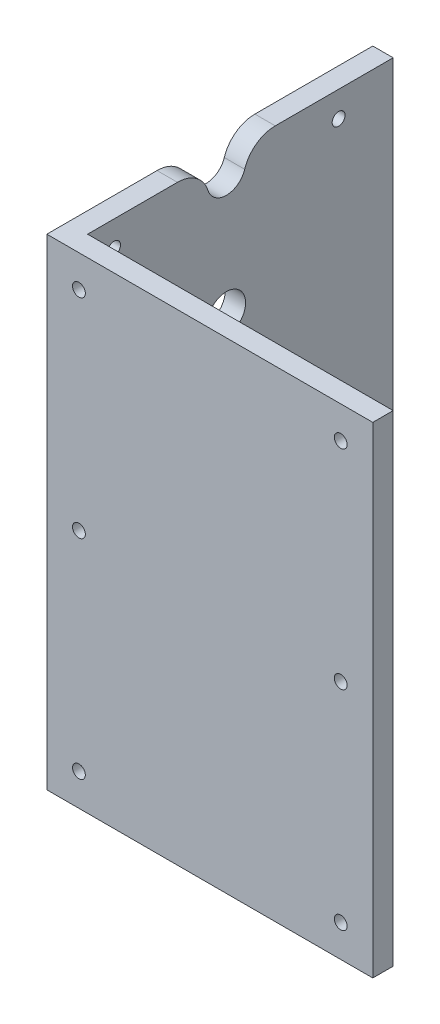
from build123d import *

# Parameters (mm, degrees)
SALIENTE_EXTRUIR1_DEPTH = 150
CROQUIS2_R              = 2
CROQUIS2_R_2            = 11
CROQUIS2_R_3            = 1.5
CROQUIS2_R_4            = 6
CORTAR_EXTRUIR1_DEPTH   = 208.714034191
REDONDEO1_R             = 10
CROQUIS3_R              = 12.5
CORTAR_EXTRUIR2_DEPTH   = 1.5
CROQUIS4_R              = 2
CROQUIS4_R_2            = 1.5
CORTAR_EXTRUIR3_DEPTH   = 208.714034191
CROQUIS6_R              = 2
CORTAR_EXTRUIR4_DEPTH   = 208.714034191


with BuildPart() as part:
    # Croquis1 → Saliente-Extruir1 (new body)
    with BuildSketch(Plane(origin=(0, 0, 0), x_dir=(1, 0, 0), z_dir=(0, 1, 0))):
        Polygon((0, 101.6), (0, 0), (101.6, 0), (101.6, 6.35), (6.35, 6.35), (6.35, 101.6), align=None)
    extrude(amount=SALIENTE_EXTRUIR1_DEPTH)

    # Croquis2 → Cortar-Extruir1 (cut, through all)
    with BuildSketch(Plane.ZY):
        with Locations((-84.6, 142)):
            Circle(CROQUIS2_R)
        with Locations((-14.6, 142)):
            Circle(CROQUIS2_R)
        with Locations((-49.6, 59.96)):
            Circle(CROQUIS2_R_2)
        with Locations((-49.6, 7.71)):
            Circle(CROQUIS2_R_3)
        with Locations((-49.6, 144.86)):
            Circle(CROQUIS2_R_4)
        with Locations((-49.6, 106.86)):
            Circle(CROQUIS2_R_4)
    extrude(amount=-CORTAR_EXTRUIR1_DEPTH, mode=Mode.SUBTRACT)

    # Redondeo1
    redondeo1_edges = [part.edges().sort_by_distance(p)[0] for p in [
        (3.175, 150, -52.695222125),
        (3.175, 150, -46.504777875),
    ]]
    fillet(redondeo1_edges, radius=REDONDEO1_R)

    # Croquis3 → Cortar-Extruir2 (cut)
    with BuildSketch(Plane.ZY):
        with Locations((-49.6, 59.96)):
            Circle(CROQUIS3_R)
    extrude(amount=-CORTAR_EXTRUIR2_DEPTH, mode=Mode.SUBTRACT)

    # Croquis4 → Cortar-Extruir3 (cut, through all)
    with BuildSketch(Plane.ZY):
        with Locations((-49.6, 78.61)):
            Circle(CROQUIS4_R)
        with Locations((-49.6, 41.31)):
            Circle(CROQUIS4_R)
        with Locations((-34.6, 59.96)):
            Circle(CROQUIS4_R_2)
        with Locations((-57.1, 46.969618943)):
            Circle(CROQUIS4_R_2)
        with Locations((-57.1, 72.950381057)):
            Circle(CROQUIS4_R_2)
        with Locations((-26.1, 59.96)):
            Circle(CROQUIS4_R_2)
        with Locations((-61.35, 39.608403011)):
            Circle(CROQUIS4_R_2)
        with Locations((-61.35, 80.311596989)):
            Circle(CROQUIS4_R_2)
    extrude(amount=-CORTAR_EXTRUIR3_DEPTH, mode=Mode.SUBTRACT)

    # Croquis6 → Cortar-Extruir4 (cut, through all)
    with BuildSketch(Plane.XY):
        with Locations((91.6, 140)):
            Circle(CROQUIS6_R)
        with Locations((91.6, 75)):
            Circle(CROQUIS6_R)
        with Locations((91.6, 10)):
            Circle(CROQUIS6_R)
        with Locations((10, 10)):
            Circle(CROQUIS6_R)
        with Locations((10, 75)):
            Circle(CROQUIS6_R)
        with Locations((10, 140)):
            Circle(CROQUIS6_R)
    extrude(amount=-CORTAR_EXTRUIR4_DEPTH, mode=Mode.SUBTRACT)


solid = part.part
